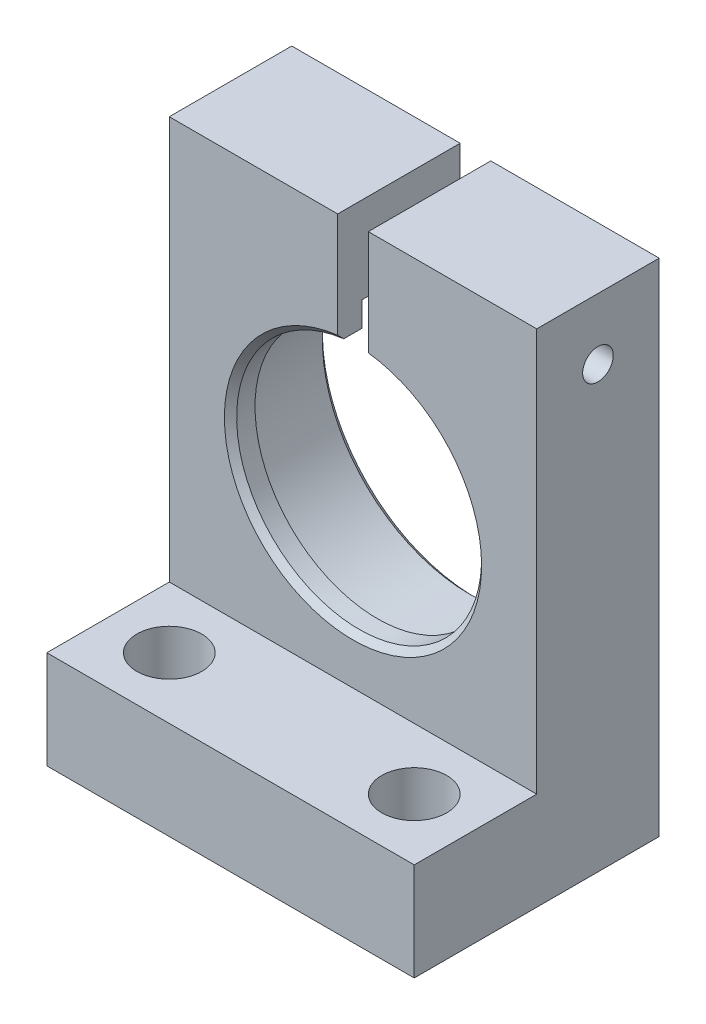
from build123d import *

# Parameters (mm, degrees)
SKETCH1_W                      = 30
SKETCH1_H                      = 40.9
SKETCH1_R                      = 12
BOSS_EXTRUDE1_DEPTH            = 10
BOSS_EXTRUDE2_START            = 2
SKETCH2_R                      = 12
SKETCH2_R_2                    = 10
BOSS_EXTRUDE2_DEPTH            = 2
SKETCH3_W                      = 2.5
SKETCH3_H                      = 9.078432584
CUT_EXTRUDE1_DEPTH             = 29.365648239
CBORE_FOR_M3_SHCS1_D           = 3.2
CBORE_FOR_M3_SHCS1_DEPTH       = 13.75
CBORE_FOR_M3_SHCS1_CBORE_D     = 6.5
CBORE_FOR_M3_SHCS1_CBORE_DEPTH = 3
TAP_DRILL_FOR_M3X0_5_TAP1_D    = 2.5
CHAMFER1_SIZE                  = 0.5
SKETCH8_W                      = 30
SKETCH8_H                      = 10
BOSS_EXTRUDE3_DEPTH            = 8
M5_CLEARANCE_HOLE1_D           = 5.3


with BuildPart() as part:
    # Sketch1 → Boss-Extrude1 (new body)
    with BuildSketch(Plane.XY):
        with Locations((0, -1.45)):
            Rectangle(SKETCH1_W, SKETCH1_H)
        Circle(SKETCH1_R, mode=Mode.SUBTRACT)
    extrude(amount=BOSS_EXTRUDE1_DEPTH)

    # Sketch2 → Boss-Extrude2 (add)
    with BuildSketch(Plane(origin=(0, 0, 10), x_dir=(-1, 0, 0), z_dir=(0, 0, -1)).offset(BOSS_EXTRUDE2_START)):
        Circle(SKETCH2_R)
        Circle(SKETCH2_R_2, mode=Mode.SUBTRACT)
    extrude(amount=-BOSS_EXTRUDE2_DEPTH)

    # Sketch3 → Cut-Extrude1 (cut, through all)
    with BuildSketch(Plane.XY.offset(10)):
        with Locations((0, 14.460783708)):
            Rectangle(SKETCH3_W, SKETCH3_H)
    extrude(amount=-CUT_EXTRUDE1_DEPTH, mode=Mode.SUBTRACT)

    # CBORE for M3 SHCS1
    with Locations(Plane(origin=(15, 0, 0), x_dir=(0, 0, -1), z_dir=(1, 0, 0))):
        with Locations((-5, 14)):
            CounterBoreHole(CBORE_FOR_M3_SHCS1_D / 2, CBORE_FOR_M3_SHCS1_CBORE_D / 2, CBORE_FOR_M3_SHCS1_CBORE_DEPTH, depth=CBORE_FOR_M3_SHCS1_DEPTH)

    # Tap Drill for M3x0.5 Tap1 (through all)
    with Locations(Plane.ZY.offset(15)):
        with Locations((5, 14)):
            Hole(TAP_DRILL_FOR_M3X0_5_TAP1_D / 2)

    # Chamfer1
    chamfer1_edges = [part.edges().sort_by_distance(p)[0] for p in [
        (0, -10, 10),
        (0, -12, 0),
    ]]
    chamfer(chamfer1_edges, length=CHAMFER1_SIZE)

    # Sketch8 → Boss-Extrude3 (add)
    with BuildSketch(Plane.XZ.offset(21.9)):
        with Locations((0, 15)):
            Rectangle(SKETCH8_W, SKETCH8_H)
    extrude(amount=-BOSS_EXTRUDE3_DEPTH)

    # M5 Clearance Hole1 (through all)
    with Locations(Plane(origin=(0, -13.9, 0), x_dir=(1, 0, 0), z_dir=(0, 1, 0))):
        with Locations((-10, -15), (10, -15)):
            Hole(M5_CLEARANCE_HOLE1_D / 2)


with BuildPart() as body_2:
    # Mirror1: mirrored copy
    add(part.part.mirror(Plane(origin=(0, 0, 0), x_dir=(0, 0, 1), z_dir=(1, 0, 0))))


solid = body_2.part
